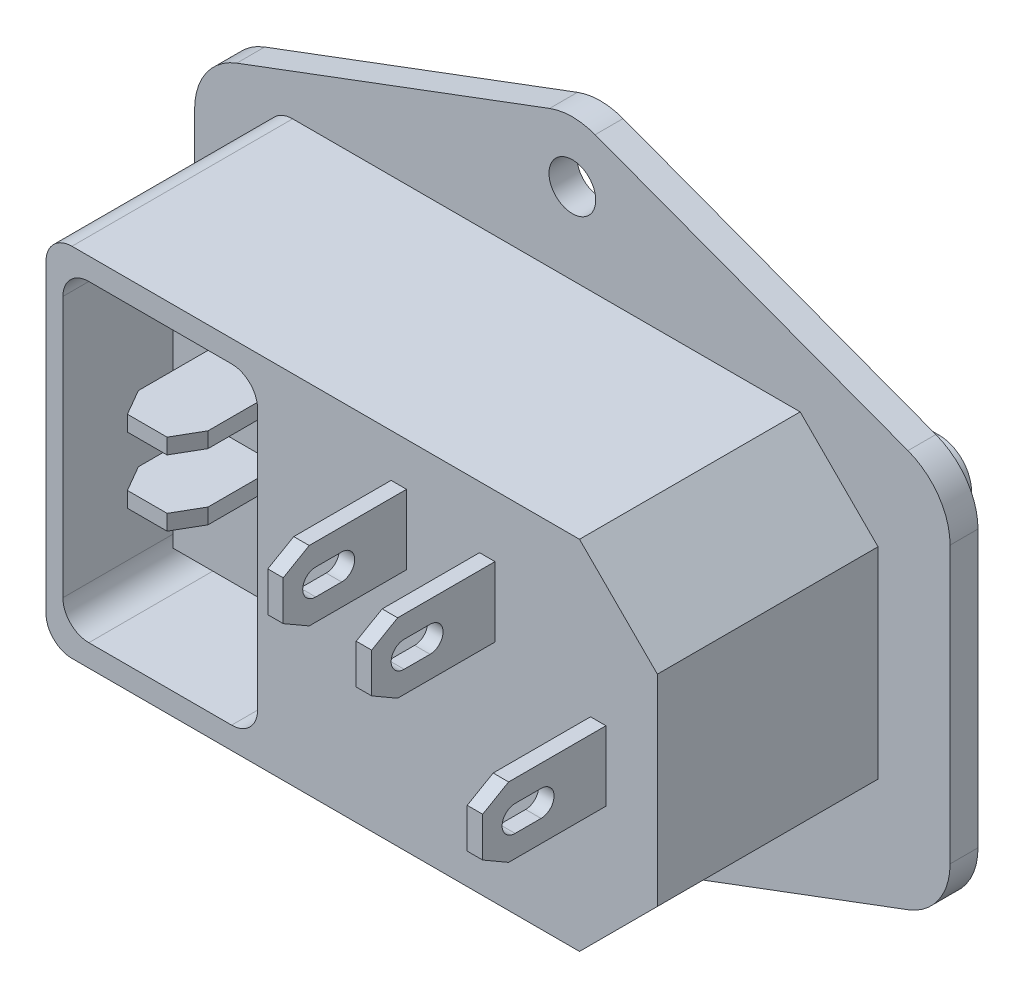
from build123d import *
from OCP.BRepFilletAPI import BRepFilletAPI_MakeChamfer

# Parameters (mm, degrees)
SKETCH1_R           = 1.8
BOSS_EXTRUDE1_DEPTH = 2.15
SKETCH2_W           = 47.1
SKETCH2_H           = 27.5
BOSS_EXTRUDE2_DEPTH = 17
CHAMFER1_SIZE       = 6
FILLET1_R           = 2
FILLET2_R           = 5
SKETCH3_W           = 4.288476248
SKETCH3_H           = 1.692819572
SKETCH3_H_2         = 1.858600316
CUT_EXTRUDE1_DEPTH  = 17
BOSS_EXTRUDE3_DEPTH = 1.4
SKETCH5_W           = 8.9
SKETCH5_H           = 24.9
SKETCH5_W_2         = 8.5
SKETCH5_H_2         = 24.5
CUT_EXTRUDE2_DEPTH  = 0.2
CUT_EXTRUDE3_START  = -20.55
CUT_EXTRUDE3_DEPTH  = 17.7
SKETCH8_W           = 11
SKETCH8_H           = 18
BOSS_EXTRUDE4_DEPTH = 11.2
SKETCH9_W           = 5.366987426
SKETCH9_H           = 1.190055558
BOSS_EXTRUDE5_DEPTH = 7.5
SKETCH10_W          = 15.35
SKETCH10_H          = 21.55
CUT_EXTRUDE4_DEPTH  = 1.5
SKETCH12_W          = 15.15
SKETCH12_H          = 21.35
SKETCH12_W_2        = 10.15
SKETCH12_H_2        = 16.35
BOSS_EXTRUDE6_DEPTH = 1.5
BOSS_EXTRUDE7_DEPTH = 5
SKETCH14_W          = 1.190055558
SKETCH14_H          = 5.366987427
BOSS_EXTRUDE8_DEPTH = 9.5
CHAMFER3_SIZE       = 1
CHAMFER3_SIZE2      = 1.732050808
CHAMFER2_SIZE       = 2
CHAMFER2_SIZE2      = 1.154700538
CUT_EXTRUDE5_DEPTH  = 10
CUT_EXTRUDE6_DEPTH  = 2
CUT_EXTRUDE7_DEPTH  = 2


with BuildPart() as part:
    # Sketch1 → Boss-Extrude1 (new body)
    with BuildSketch(Plane.XY):
        Polygon((29.1, -14.1), (29.1, 14.1), (0, 25), (-29.1, 14.1), (-29.1, -14.1), (0, -25), align=None)
        with Locations(Location((0, 20, 0), (0, 0, 180))):
            Circle(SKETCH1_R, mode=Mode.SUBTRACT)
        with Locations(Location((0, -20, 0), (0, 0, 180))):
            Circle(SKETCH1_R, mode=Mode.SUBTRACT)
    extrude(amount=BOSS_EXTRUDE1_DEPTH)

    # Sketch2 → Boss-Extrude2 (add)
    with BuildSketch(Plane.XY.offset(2.15)):
        Rectangle(SKETCH2_W, SKETCH2_H)
    extrude(amount=BOSS_EXTRUDE2_DEPTH)

    # Chamfer1
    chamfer1_edges = [part.edges().sort_by_distance(p)[0] for p in [
        (23.55, -13.75, 10.65),
        (23.55, 13.75, 10.65),
    ]]
    chamfer(chamfer1_edges, length=CHAMFER1_SIZE)

    # Fillet1
    fillet1_edges = [part.edges().sort_by_distance(p)[0] for p in [
        (-23.55, 13.75, 10.65),
        (-23.55, -13.75, 10.65),
    ]]
    fillet(fillet1_edges, radius=FILLET1_R)

    # Fillet2
    fillet2_edges = [part.edges().sort_by_distance(p)[0] for p in [
        (-29.1, 14.1, 1.075),
        (0, 25, 1.075),
        (29.1, 14.1, 1.075),
        (29.1, -14.1, 1.075),
        (0, -25, 1.075),
        (-29.1, -14.1, 1.075),
    ]]
    fillet(fillet2_edges, radius=FILLET2_R)

    # Sketch3 → Cut-Extrude1 (cut)
    with BuildSketch(Plane(origin=(0, 0, 0), x_dir=(-1, 0, 0), z_dir=(0, 0, -1))):
        Polygon((-16.2, -12.1), (-6.2, -12.1), (-6.2, 12.1), (-16.2, 12.1), (-22.2, 6.1), (-22.2, -6.1), align=None)
        with Locations((-11.614985757, -7.531296487)):
            Rectangle(SKETCH3_W, SKETCH3_H, mode=Mode.SUBTRACT)
        with Locations((-17.821990853, 0)):
            Rectangle(SKETCH3_W, SKETCH3_H_2, mode=Mode.SUBTRACT)
        with Locations((-11.614985757, 7.531296487)):
            Rectangle(SKETCH3_W, SKETCH3_H, mode=Mode.SUBTRACT)
    extrude(amount=-CUT_EXTRUDE1_DEPTH, mode=Mode.SUBTRACT)

    # Sketch4 → Boss-Extrude3 (add)
    with BuildSketch(Plane(origin=(0, 0, 0), x_dir=(-1, 0, 0), z_dir=(0, 0, -1))):
        with BuildLine():
            Line((-24.7, -14), (24.7, -14))
            ThreePointArc((24.7, -14), (26.467766953, -13.267766953), (27.2, -11.5))
            Line((27.2, -11.5), (27.2, 11.5))
            ThreePointArc((27.2, 11.5), (26.467766953, 13.267766953), (24.7, 14))
            Line((24.7, 14), (-24.7, 14))
            ThreePointArc((-24.7, 14), (-26.467766953, 13.267766953), (-27.2, 11.5))
            Line((-27.2, 11.5), (-27.2, -11.5))
            ThreePointArc((-27.2, -11.5), (-26.467766953, -13.267766953), (-24.7, -14))
        make_face()
        Polygon((-6.2, -12.1), (-6.2, 12.1), (-16.2, 12.1), (-22.2, 6.1), (-22.2, -6.1), (-16.2, -12.1), align=None, mode=Mode.SUBTRACT)
    extrude(amount=BOSS_EXTRUDE3_DEPTH)

    # Sketch5 → Cut-Extrude2 (cut)
    # profile 1 of 2: a face of its own
    with BuildSketch(Plane(origin=(0, 0, -1.4), x_dir=(-1, 0, 0), z_dir=(0, 0, -1))):
        with Locations((1.15, 0)):
            Rectangle(SKETCH5_W, SKETCH5_H)
        with Locations((1.15, 0)):
            Rectangle(SKETCH5_W_2, SKETCH5_H_2, mode=Mode.SUBTRACT)
    # profile 2 of 2: a face of its own
    with BuildSketch(Plane(origin=(0, 0, -1.4), x_dir=(-1, 0, 0), z_dir=(0, 0, -1))):
        Polygon((-1.689278438, -9.440617978), (4.448211796, -9.440617978), (4.448211796, -4.751257717), (2.988338361, -4.751257717), (2.988338361, 4.751257717), (4.448211796, 4.751257717), (4.448211796, 9.440617978), (-1.689278438, 9.440617978), (-1.689278438, 4.751257717), (-0.229405004, 4.751257717), (-0.229405004, -4.751257717), (-1.689278438, -4.751257717), align=None)
        Polygon((2.688338361, 5.051257717), (4.148211796, 5.051257717), (4.148211796, 9.140617978), (-1.389278438, 9.140617978), (-1.389278438, 5.051257717), (0.070594996, 5.051257717), (0.070594996, -5.051257717), (-1.389278438, -5.051257717), (-1.389278438, -9.140617978), (4.148211796, -9.140617978), (4.148211796, -5.051257717), (2.688338361, -5.051257717), align=None, mode=Mode.SUBTRACT)
    extrude(amount=-CUT_EXTRUDE2_DEPTH, mode=Mode.SUBTRACT)

    # Sketch6 → Cut-Extrude3 (cut)
    with BuildSketch(Plane(origin=(0, 0, -1.4), x_dir=(-1, 0, 0), z_dir=(0, 0, -1)).offset(CUT_EXTRUDE3_START)):
        with BuildLine():
            Line((9.25, -12.05), (20.25, -12.05))
            ThreePointArc((20.25, -12.05), (21.664213562, -11.464213562), (22.25, -10.05))
            Line((22.25, -10.05), (22.25, 10.05))
            ThreePointArc((22.25, 10.05), (21.664213562, 11.464213562), (20.25, 12.05))
            Line((20.25, 12.05), (9.25, 12.05))
            ThreePointArc((9.25, 12.05), (7.835786438, 11.464213562), (7.25, 10.05))
            Line((7.25, 10.05), (7.25, -10.05))
            ThreePointArc((7.25, -10.05), (7.835786438, -11.464213562), (9.25, -12.05))
        make_face()
    extrude(amount=CUT_EXTRUDE3_DEPTH, mode=Mode.SUBTRACT)

    # Sketch8 → Boss-Extrude4 (add)
    with BuildSketch(Plane.XY.offset(1.45)):
        with Locations((-14.75, 0)):
            Rectangle(SKETCH8_W, SKETCH8_H)
    extrude(amount=BOSS_EXTRUDE4_DEPTH)

    # Sketch9 → Boss-Extrude5 (add)
    with BuildSketch(Plane.XY.offset(12.65)):
        with Locations((-14.75, 5.083540573)):
            Rectangle(SKETCH9_W, SKETCH9_H)
        with Locations((-14.75, 0)):
            Rectangle(SKETCH9_W, SKETCH9_H)
    extrude(amount=BOSS_EXTRUDE5_DEPTH)

    # Sketch10 → Cut-Extrude4 (cut)
    with BuildSketch(Plane(origin=(0, 0, -1.4), x_dir=(-1, 0, 0), z_dir=(0, 0, -1))):
        with Locations((14.75, 0)):
            Rectangle(SKETCH10_W, SKETCH10_H)
    extrude(amount=-CUT_EXTRUDE4_DEPTH, mode=Mode.SUBTRACT)

    # Sketch12 → Boss-Extrude6 (add)
    with BuildSketch(Plane(origin=(0, 0, 0.1), x_dir=(-1, 0, 0), z_dir=(0, 0, -1))):
        with Locations((14.75, 0)):
            Rectangle(SKETCH12_W, SKETCH12_H)
        with Locations((14.75, 0)):
            Rectangle(SKETCH12_W_2, SKETCH12_H_2, mode=Mode.SUBTRACT)
    extrude(amount=BOSS_EXTRUDE6_DEPTH)

    # Sketch13 → Boss-Extrude7 (add, symmetric)
    with BuildSketch(Plane(origin=(-14.75, 0, 0), x_dir=(0, 0, -1), z_dir=(1, 0, 0))):
        with BuildLine():
            Line((-0.1, -7.425430553), (-0.1, 7.592832676))
            add(Edge.make_bspline(
                [(-0.1, 7.592832676), (3.659456074, 7.436561647), (6.740460895, 5.170946804)],
                knots=[0, 0, 0, 1, 1, 1], degree=2))
            add(Edge.make_bspline(
                [(1.4, -7.425430553), (1.349217411, 0.057710123), (6.740460895, 5.170946804)],
                knots=[0, 0, 0, 1, 1, 1], degree=2))
            Line((1.4, -7.425430553), (-0.1, -7.425430553))
        make_face()
    extrude(amount=BOSS_EXTRUDE7_DEPTH, both=True)

    # Sketch14 → Boss-Extrude8 (add)
    with BuildSketch(Plane.XY.offset(19.15)):
        with Locations((3.631590691, 7.738834836)):
            Rectangle(SKETCH14_W, SKETCH14_H)
        with Locations((10.444142343, 6.321458318)):
            Rectangle(SKETCH14_W, SKETCH14_H)
        with Locations((18.994123277, -0.353927865)):
            Rectangle(SKETCH14_W, SKETCH14_H)
    extrude(amount=BOSS_EXTRUDE8_DEPTH)

    # Chamfer3: one chamfer whose edges measure the first distance from different faces: ONE call of the kernel's chamfer builder (chamfer() names one face for all edges)
    chamfer3_edges_1 = [part.edges().sort_by_distance(p)[0] for p in [
        (-22.325, 0, -1.4),
    ]]
    chamfer3_side_1 = [part.faces().sort_by_distance(p)[0] for p in [
        (-22.325, 0, -0.65),
    ]]
    chamfer3_edges_2 = [part.edges().sort_by_distance(p)[0] for p in [
        (-14.75, 10.675, -1.4),
    ]]
    chamfer3_side_2 = [part.faces().sort_by_distance(p)[0] for p in [
        (-14.75, 10.675, -0.65),
    ]]
    chamfer3_edges_3 = [part.edges().sort_by_distance(p)[0] for p in [
        (-7.175, 0, -1.4),
    ]]
    chamfer3_side_3 = [part.faces().sort_by_distance(p)[0] for p in [
        (-7.175, 0, -0.65),
    ]]
    chamfer3_edges_4 = [part.edges().sort_by_distance(p)[0] for p in [
        (-14.75, -10.675, -1.4),
    ]]
    chamfer3_side_4 = [part.faces().sort_by_distance(p)[0] for p in [
        (-14.75, -10.675, -0.65),
    ]]
    chamfer3 = BRepFilletAPI_MakeChamfer(part.part.solid().wrapped)
    for e in chamfer3_edges_1:
        chamfer3.Add(CHAMFER3_SIZE, CHAMFER3_SIZE2, e.wrapped, chamfer3_side_1[0].wrapped)  # the first distance lies on this face
    for e in chamfer3_edges_2:
        chamfer3.Add(CHAMFER3_SIZE, CHAMFER3_SIZE2, e.wrapped, chamfer3_side_2[0].wrapped)  # the first distance lies on this face
    for e in chamfer3_edges_3:
        chamfer3.Add(CHAMFER3_SIZE, CHAMFER3_SIZE2, e.wrapped, chamfer3_side_3[0].wrapped)  # the first distance lies on this face
    for e in chamfer3_edges_4:
        chamfer3.Add(CHAMFER3_SIZE, CHAMFER3_SIZE2, e.wrapped, chamfer3_side_4[0].wrapped)  # the first distance lies on this face
    add(Compound.cast(chamfer3.Shape()), mode=Mode.REPLACE)

    # Chamfer2: one chamfer whose edges measure the first distance from different faces: ONE call of the kernel's chamfer builder (chamfer() names one face for all edges)
    chamfer2_edges_1 = [part.edges().sort_by_distance(p)[0] for p in [
        (15.677752729, 0, 0),
    ]]
    chamfer2_side_1 = [part.faces().sort_by_distance(p)[0] for p in [
        (15.677752729, 0, 8.5),
    ]]
    chamfer2_edges_2 = [part.edges().sort_by_distance(p)[0] for p in [
        (19.966228977, 0, 0),
    ]]
    chamfer2_side_2 = [part.faces().sort_by_distance(p)[0] for p in [
        (19.966228977, 0, 8.5),
    ]]
    chamfer2_edges_3 = [part.edges().sort_by_distance(p)[0] for p in [
        (9.470747633, 7.531296487, 0),
    ]]
    chamfer2_side_3 = [part.faces().sort_by_distance(p)[0] for p in [
        (9.470747633, 7.531296487, 8.5),
    ]]
    chamfer2_edges_4 = [part.edges().sort_by_distance(p)[0] for p in [
        (13.759223881, 7.531296487, 0),
    ]]
    chamfer2_side_4 = [part.faces().sort_by_distance(p)[0] for p in [
        (13.759223881, 7.531296487, 8.5),
    ]]
    chamfer2_edges_5 = [part.edges().sort_by_distance(p)[0] for p in [
        (13.759223881, -7.531296487, 0),
    ]]
    chamfer2_side_5 = [part.faces().sort_by_distance(p)[0] for p in [
        (13.759223881, -7.531296487, 8.5),
    ]]
    chamfer2_edges_6 = [part.edges().sort_by_distance(p)[0] for p in [
        (9.470747633, -7.531296487, 0),
    ]]
    chamfer2_side_6 = [part.faces().sort_by_distance(p)[0] for p in [
        (9.470747633, -7.531296487, 8.5),
    ]]
    chamfer2_edges_7 = [part.edges().sort_by_distance(p)[0] for p in [
        (-12.066506287, 5.083540573, 20.15),
    ]]
    chamfer2_side_7 = [part.faces().sort_by_distance(p)[0] for p in [
        (-12.066506287, 5.083540573, 16.4),
    ]]
    chamfer2_edges_8 = [part.edges().sort_by_distance(p)[0] for p in [
        (-17.433493713, 5.083540573, 20.15),
    ]]
    chamfer2_side_8 = [part.faces().sort_by_distance(p)[0] for p in [
        (-17.433493713, 5.083540573, 16.4),
    ]]
    chamfer2_edges_9 = [part.edges().sort_by_distance(p)[0] for p in [
        (-12.066506287, 0, 20.15),
    ]]
    chamfer2_side_9 = [part.faces().sort_by_distance(p)[0] for p in [
        (-12.066506287, 0, 16.4),
    ]]
    chamfer2_edges_10 = [part.edges().sort_by_distance(p)[0] for p in [
        (-17.433493713, 0, 20.15),
    ]]
    chamfer2_side_10 = [part.faces().sort_by_distance(p)[0] for p in [
        (-17.433493713, 0, 16.4),
    ]]
    chamfer2_edges_11 = [part.edges().sort_by_distance(p)[0] for p in [
        (3.631590691, 10.422328549, 28.65),
    ]]
    chamfer2_side_11 = [part.faces().sort_by_distance(p)[0] for p in [
        (3.631590691, 10.422328549, 23.9),
    ]]
    chamfer2_edges_12 = [part.edges().sort_by_distance(p)[0] for p in [
        (3.631590691, 5.055341122, 28.65),
    ]]
    chamfer2_side_12 = [part.faces().sort_by_distance(p)[0] for p in [
        (3.631590691, 5.055341122, 23.9),
    ]]
    chamfer2_edges_13 = [part.edges().sort_by_distance(p)[0] for p in [
        (10.444142343, 3.637964604, 28.65),
    ]]
    chamfer2_side_13 = [part.faces().sort_by_distance(p)[0] for p in [
        (10.444142343, 3.637964604, 23.9),
    ]]
    chamfer2_edges_14 = [part.edges().sort_by_distance(p)[0] for p in [
        (10.444142343, 9.004952031, 28.65),
    ]]
    chamfer2_side_14 = [part.faces().sort_by_distance(p)[0] for p in [
        (10.444142343, 9.004952031, 23.9),
    ]]
    chamfer2_edges_15 = [part.edges().sort_by_distance(p)[0] for p in [
        (18.994123277, -3.037421579, 28.65),
    ]]
    chamfer2_side_15 = [part.faces().sort_by_distance(p)[0] for p in [
        (18.994123277, -3.037421579, 23.9),
    ]]
    chamfer2_edges_16 = [part.edges().sort_by_distance(p)[0] for p in [
        (18.994123277, 2.329565848, 28.65),
    ]]
    chamfer2_side_16 = [part.faces().sort_by_distance(p)[0] for p in [
        (18.994123277, 2.329565848, 23.9),
    ]]
    chamfer2 = BRepFilletAPI_MakeChamfer(part.part.solid().wrapped)
    for e in chamfer2_edges_1:
        chamfer2.Add(CHAMFER2_SIZE, CHAMFER2_SIZE2, e.wrapped, chamfer2_side_1[0].wrapped)  # the first distance lies on this face
    for e in chamfer2_edges_2:
        chamfer2.Add(CHAMFER2_SIZE, CHAMFER2_SIZE2, e.wrapped, chamfer2_side_2[0].wrapped)  # the first distance lies on this face
    for e in chamfer2_edges_3:
        chamfer2.Add(CHAMFER2_SIZE, CHAMFER2_SIZE2, e.wrapped, chamfer2_side_3[0].wrapped)  # the first distance lies on this face
    for e in chamfer2_edges_4:
        chamfer2.Add(CHAMFER2_SIZE, CHAMFER2_SIZE2, e.wrapped, chamfer2_side_4[0].wrapped)  # the first distance lies on this face
    for e in chamfer2_edges_5:
        chamfer2.Add(CHAMFER2_SIZE, CHAMFER2_SIZE2, e.wrapped, chamfer2_side_5[0].wrapped)  # the first distance lies on this face
    for e in chamfer2_edges_6:
        chamfer2.Add(CHAMFER2_SIZE, CHAMFER2_SIZE2, e.wrapped, chamfer2_side_6[0].wrapped)  # the first distance lies on this face
    for e in chamfer2_edges_7:
        chamfer2.Add(CHAMFER2_SIZE, CHAMFER2_SIZE2, e.wrapped, chamfer2_side_7[0].wrapped)  # the first distance lies on this face
    for e in chamfer2_edges_8:
        chamfer2.Add(CHAMFER2_SIZE, CHAMFER2_SIZE2, e.wrapped, chamfer2_side_8[0].wrapped)  # the first distance lies on this face
    for e in chamfer2_edges_9:
        chamfer2.Add(CHAMFER2_SIZE, CHAMFER2_SIZE2, e.wrapped, chamfer2_side_9[0].wrapped)  # the first distance lies on this face
    for e in chamfer2_edges_10:
        chamfer2.Add(CHAMFER2_SIZE, CHAMFER2_SIZE2, e.wrapped, chamfer2_side_10[0].wrapped)  # the first distance lies on this face
    for e in chamfer2_edges_11:
        chamfer2.Add(CHAMFER2_SIZE, CHAMFER2_SIZE2, e.wrapped, chamfer2_side_11[0].wrapped)  # the first distance lies on this face
    for e in chamfer2_edges_12:
        chamfer2.Add(CHAMFER2_SIZE, CHAMFER2_SIZE2, e.wrapped, chamfer2_side_12[0].wrapped)  # the first distance lies on this face
    for e in chamfer2_edges_13:
        chamfer2.Add(CHAMFER2_SIZE, CHAMFER2_SIZE2, e.wrapped, chamfer2_side_13[0].wrapped)  # the first distance lies on this face
    for e in chamfer2_edges_14:
        chamfer2.Add(CHAMFER2_SIZE, CHAMFER2_SIZE2, e.wrapped, chamfer2_side_14[0].wrapped)  # the first distance lies on this face
    for e in chamfer2_edges_15:
        chamfer2.Add(CHAMFER2_SIZE, CHAMFER2_SIZE2, e.wrapped, chamfer2_side_15[0].wrapped)  # the first distance lies on this face
    for e in chamfer2_edges_16:
        chamfer2.Add(CHAMFER2_SIZE, CHAMFER2_SIZE2, e.wrapped, chamfer2_side_16[0].wrapped)  # the first distance lies on this face
    add(Compound.cast(chamfer2.Shape()), mode=Mode.REPLACE)

    # Sketch15 → Cut-Extrude5 (cut)
    with BuildSketch(Plane(origin=(19.589151056, 0, 0), x_dir=(0, 0, -1), z_dir=(1, 0, 0))):
        with BuildLine():
            Line((-26.15, 0.646072134), (-24.15, 0.646072134))
            ThreePointArc((-24.15, 0.646072134), (-23.15, -0.353927866), (-24.15, -1.353927866))
            Line((-24.15, -1.353927866), (-26.15, -1.353927866))
            ThreePointArc((-26.15, -1.353927866), (-27.15, -0.353927866), (-26.15, 0.646072134))
        make_face()
    extrude(amount=-CUT_EXTRUDE5_DEPTH, mode=Mode.SUBTRACT)

    # Sketch16 → Cut-Extrude6 (cut)
    with BuildSketch(Plane(origin=(11.039170122, 0, 0), x_dir=(0, 0, -1), z_dir=(1, 0, 0))):
        with BuildLine():
            Line((-24.15, 5.321458318), (-26.15, 5.321458318))
            ThreePointArc((-26.15, 5.321458318), (-27.15, 6.321458318), (-26.15, 7.321458318))
            Line((-26.15, 7.321458318), (-24.15, 7.321458318))
            ThreePointArc((-24.15, 7.321458318), (-23.15, 6.321458318), (-24.15, 5.321458318))
        make_face()
    extrude(amount=-CUT_EXTRUDE6_DEPTH, mode=Mode.SUBTRACT)

    # Sketch17 → Cut-Extrude7 (cut)
    with BuildSketch(Plane.ZY.offset(-3.036562912)):
        with BuildLine():
            Line((24.15, 8.738799039), (26.15, 8.738799039))
            ThreePointArc((26.15, 8.738799039), (27.149964203, 7.738834836), (26.15, 6.738870633))
            Line((26.15, 6.738870633), (24.15, 6.738870633))
            ThreePointArc((24.15, 6.738870633), (23.150035797, 7.738834836), (24.15, 8.738799039))
        make_face()
    extrude(amount=-CUT_EXTRUDE7_DEPTH, mode=Mode.SUBTRACT)


solid = part.part
